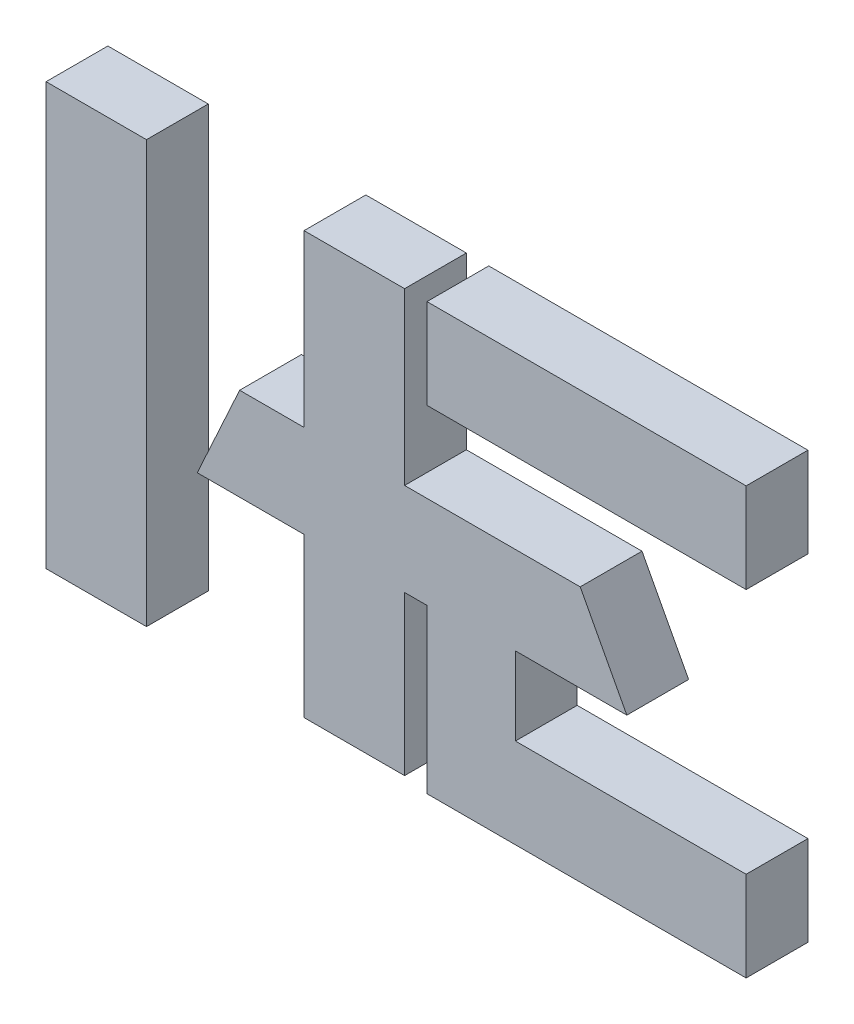
from build123d import *

# Parameters (mm, degrees)
BOSS_EXTRUDE1_DEPTH   = 2
SKETCH1_W             = 2.5
SKETCH1_H             = 10.5
BOSS_EXTRUDE1_2_DEPTH = 2
SKETCH1_W_2           = 7.945592629
SKETCH1_H_2           = 2.237026011
BOSS_EXTRUDE1_3_DEPTH = 2
SCALE2_SCALE          = 1.3
SKETCH2_W             = 28.996582699
SKETCH2_H             = 17.123330173
CUT_EXTRUDE1_DEPTH    = 0.6


with BuildPart() as part:
    # Sketch1 → Boss-Extrude1 (new body)
    with BuildSketch(Plane.XY):
        Polygon((-3.895135439, 1.034757073), (-4.950527249, -1.272027883), (-3.855272926, -1.272027883), (-2.291707931, -1.272027883), (-2.291707931, -5.222208659), (0.211078362, -5.222208659), (0.211078362, -1.272027883), (0.768928319, -1.272027883), (0.768928319, -5.333374023), (8.714520948, -5.333374023), (8.714520948, -3.096348012), (2.970174095, -3.096348012), (2.970174095, -1.151411676), (4.583415862, -1.151411676), (5.744346853, -1.151411676), (4.583415862, 1.034757073), (2.970174095, 1.034757073), (0.768928319, 1.034757073), (0.211078362, 1.034757073), (0.211078362, 5.277791341), (-2.291707931, 5.277791341), (-2.291707931, 1.034757073), align=None)
    extrude(amount=BOSS_EXTRUDE1_DEPTH)


with BuildPart() as body_2:
    # Sketch1 → Boss-Extrude1 2 (new body)
    with BuildSketch(Plane.XY):
        with Locations((-7.464520948, 0.027791341)):
            Rectangle(SKETCH1_W, SKETCH1_H)
    extrude(amount=BOSS_EXTRUDE1_2_DEPTH)


with BuildPart() as body_3:
    # Sketch1 → Boss-Extrude1 3 (new body)
    with BuildSketch(Plane.XY):
        with Locations((4.741724634, 4.159278335)):
            Rectangle(SKETCH1_W_2, SKETCH1_H_2)
    extrude(amount=BOSS_EXTRUDE1_3_DEPTH)


with BuildPart() as body_2_1:
    # Scale2: scaled about (0, 0, 0)
    add(body_2.part.scale(SCALE2_SCALE))


with BuildPart() as part_1:
    # Scale2: scaled about (0, 0, 0)
    add(part.part.scale(SCALE2_SCALE))


with BuildPart() as body_3_1:
    # Scale2: scaled about (0, 0, 0)
    add(body_3.part.scale(SCALE2_SCALE))


with BuildPart() as cut_extrude1_tool:
    # Sketch2 → Cut-Extrude1 (new body)
    with BuildSketch(Plane.XY.offset(2.6)):
        with Locations((-0.525007764, 0.222336618)):
            Rectangle(SKETCH2_W, SKETCH2_H)
    extrude(amount=-CUT_EXTRUDE1_DEPTH)


with BuildPart() as part_2:
    add(part_1.part)

    # Cut-Extrude1: cut by cut_extrude1_tool
    add(cut_extrude1_tool.part, mode=Mode.SUBTRACT)


with BuildPart() as body_2_2:
    add(body_2_1.part)

    # Cut-Extrude1: cut by cut_extrude1_tool
    add(cut_extrude1_tool.part, mode=Mode.SUBTRACT)


with BuildPart() as body_3_2:
    add(body_3_1.part)

    # Cut-Extrude1: cut by cut_extrude1_tool
    add(cut_extrude1_tool.part, mode=Mode.SUBTRACT)


solid = Compound([part_2.part, body_2_2.part, body_3_2.part])
